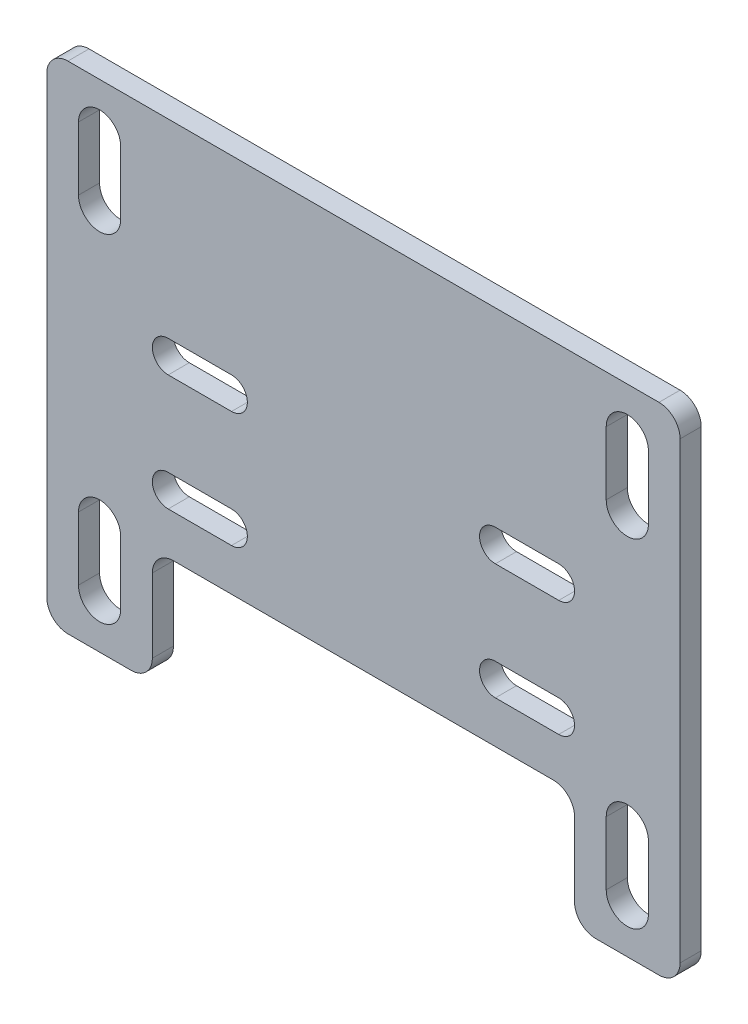
from build123d import *

# Parameters (mm, degrees)
SKETCH1_W           = 60
SKETCH1_H           = 47
BOSS_EXTRUDE1_DEPTH = 2
SKETCH2_W           = 40
SKETCH2_H           = 11
CUT_EXTRUDE1_DEPTH  = 2
CUT_EXTRUDE2_DEPTH  = 2
CUT_EXTRUDE3_DEPTH  = 2
CUT_EXTRUDE4_DEPTH  = 2
CUT_EXTRUDE5_DEPTH  = 2
FILLET1_R           = 2


with BuildPart() as part:
    # Sketch1 → Boss-Extrude1 (new body)
    with BuildSketch(Plane.XY):
        Rectangle(SKETCH1_W, SKETCH1_H)
    extrude(amount=BOSS_EXTRUDE1_DEPTH)

    # Sketch2 → Cut-Extrude1 (cut)
    with BuildSketch(Plane(origin=(0, 0, 0), x_dir=(-1, 0, 0), z_dir=(0, 0, -1))):
        with Locations((0, -18)):
            Rectangle(SKETCH2_W, SKETCH2_H)
    extrude(amount=-CUT_EXTRUDE1_DEPTH, mode=Mode.SUBTRACT)

    # Sketch3 → Cut-Extrude2 (cut)
    with BuildSketch(Plane(origin=(0, 0, 0), x_dir=(-1, 0, 0), z_dir=(0, 0, -1))):
        with BuildLine():
            Line((27, -13), (27, -19))
            ThreePointArc((27, -19), (25, -21), (23, -19))
            Line((23, -19), (23, -13))
            ThreePointArc((23, -13), (25, -11), (27, -13))
        make_face()
    cut_extrude2 = extrude(amount=-CUT_EXTRUDE2_DEPTH, mode=Mode.SUBTRACT)

    # Sketch4 → Cut-Extrude3 (cut)
    with BuildSketch(Plane(origin=(0, 0, 0), x_dir=(-1, 0, 0), z_dir=(0, 0, -1))):
        with BuildLine():
            Line((27, 19), (27, 13))
            ThreePointArc((27, 13), (25, 11), (23, 13))
            Line((23, 13), (23, 19))
            ThreePointArc((23, 19), (25, 21), (27, 19))
        make_face()
    cut_extrude3 = extrude(amount=-CUT_EXTRUDE3_DEPTH, mode=Mode.SUBTRACT)

    # Sketch5 → Cut-Extrude4 (cut)
    with BuildSketch(Plane(origin=(0, 0, 0), x_dir=(-1, 0, 0), z_dir=(0, 0, -1))):
        with BuildLine():
            Line((12.5, -5.5), (18.5, -5.5))
            ThreePointArc((18.5, -5.5), (20, -7), (18.5, -8.5))
            Line((18.5, -8.5), (12.5, -8.5))
            ThreePointArc((12.5, -8.5), (11, -7), (12.5, -5.5))
        make_face()
    cut_extrude4 = extrude(amount=-CUT_EXTRUDE4_DEPTH, mode=Mode.SUBTRACT)

    # Sketch6 → Cut-Extrude5 (cut)
    with BuildSketch(Plane(origin=(0, 0, 0), x_dir=(-1, 0, 0), z_dir=(0, 0, -1))):
        with BuildLine():
            Line((12.5, 5.5), (18.5, 5.5))
            ThreePointArc((18.5, 5.5), (20, 4), (18.5, 2.5))
            Line((18.5, 2.5), (12.5, 2.5))
            ThreePointArc((12.5, 2.5), (11, 4), (12.5, 5.5))
        make_face()
    cut_extrude5 = extrude(amount=-CUT_EXTRUDE5_DEPTH, mode=Mode.SUBTRACT)

    # Mirror1: Cut-Extrude2, Cut-Extrude3, Cut-Extrude4, Cut-Extrude5 across plane
    add(cut_extrude2.mirror(Plane.ZY), mode=Mode.SUBTRACT)
    add(cut_extrude3.mirror(Plane.ZY), mode=Mode.SUBTRACT)
    add(cut_extrude4.mirror(Plane.ZY), mode=Mode.SUBTRACT)
    add(cut_extrude5.mirror(Plane.ZY), mode=Mode.SUBTRACT)

    # Fillet1
    fillet1_edges = [part.edges().sort_by_distance(p)[0] for p in [
        (-20, -12.5, 1),
        (-20, -23.5, 1),
        (20, -23.5, 1),
        (20, -12.5, 1),
        (30, -23.5, 1),
        (-30, -23.5, 1),
        (-30, 23.5, 1),
        (30, 23.5, 1),
    ]]
    fillet(fillet1_edges, radius=FILLET1_R)


solid = part.part
